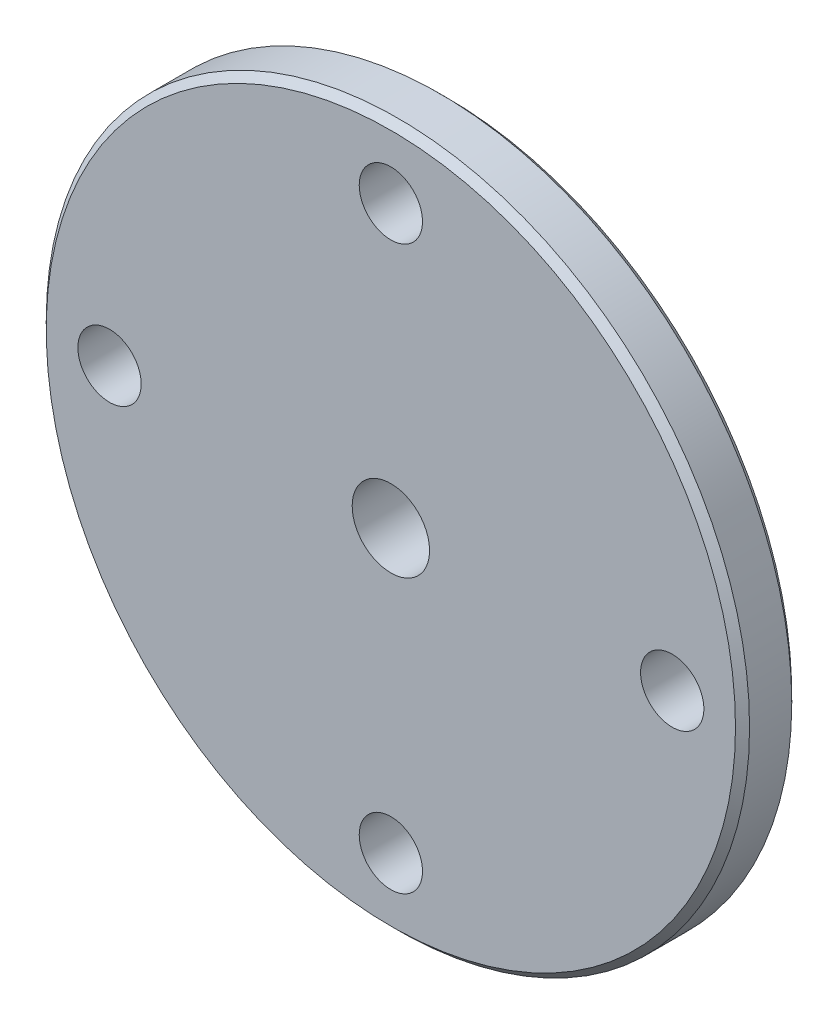
from build123d import *

# Parameters (mm, degrees)
SKETCH_1_W              = 25
SKETCH_1_H              = 4
HOLE_WIZARD_5_5_5_5_1_D = 5.5
HOLE_WIZARD_4_5_4_5_1_D = 4.5
CHAMFER_1_SIZE          = 0.5


with BuildPart() as part:
    # 草图1 → 旋转1 (revolve)
    with BuildSketch(Plane(origin=(0, 0, 0), x_dir=(1, 0, 0), z_dir=(0, 1, 0))):
        with Locations((12.5, -2)):
            Rectangle(SKETCH_1_W, SKETCH_1_H)
    revolve(axis=Axis((0, 0, 0), (0, 0, 1)))

    # Ø5.5 (5.5) 直径孔1 (through all)
    with Locations(Plane(origin=(0, 0, 0), x_dir=(-1, 0, 0), z_dir=(0, 0, -1))):
        with Locations((0, 0)):
            Hole(HOLE_WIZARD_5_5_5_5_1_D / 2)

    # Ø4.5 (4.5) 直径孔1 (through all)
    with Locations(Plane(origin=(0, 0, 0), x_dir=(-1, 0, 0), z_dir=(0, 0, -1))):
        with Locations((0, 20), (-20, 0), (0, -20), (20, 0)):
            Hole(HOLE_WIZARD_4_5_4_5_1_D / 2)

    # 倒角1
    chamfer_1_edges = [part.edges().sort_by_distance(p)[0] for p in [
        (-25, 0, 4),
        (-25, 0, 0),
    ]]
    chamfer(chamfer_1_edges, length=CHAMFER_1_SIZE)


solid = part.part
